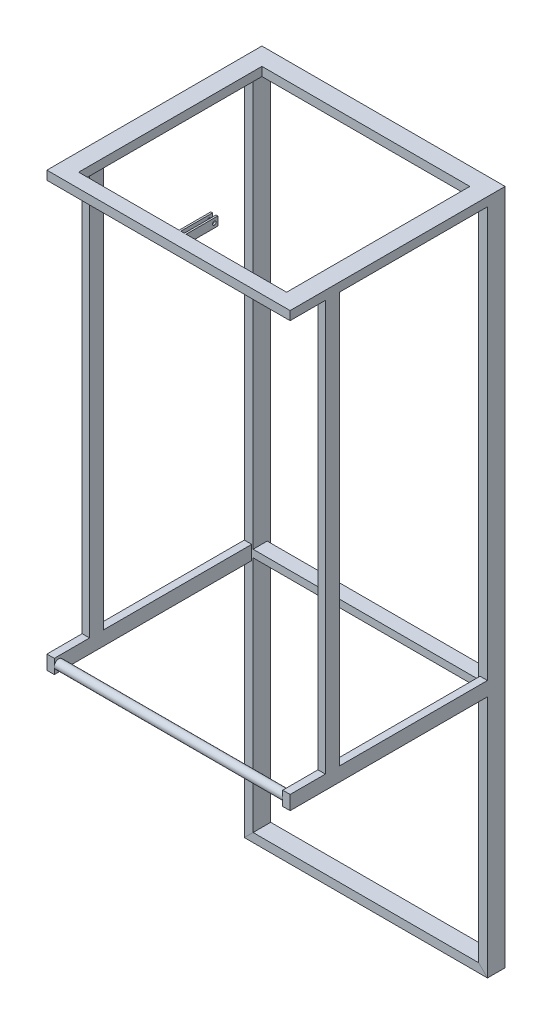
from build123d import *

# Parameters (mm, degrees)
SKETCH5_W            = 50
SKETCH5_H            = 25
SKETCH7_W            = 40
SKETCH7_H            = 21
SKETCH9_W            = 21
SKETCH9_H            = 40
BOSS_EXTRUDE2_DEPTH  = 560
SKETCH10_W           = 50
SKETCH10_H           = 25
BOSS_EXTRUDE3_DEPTH  = 560
SKETCH11_W           = 40
SKETCH11_H           = 25
BOSS_EXTRUDE4_DEPTH  = 590
BOSS_EXTRUDE7_REACH  = 1360.803
SKETCH13_W           = 21
SKETCH13_H           = 40
BOSS_EXTRUDE11_REACH = 1299.213
SKETCH19_R           = 12.5
SKETCH21_W           = 5
SKETCH21_H           = 25
BOSS_EXTRUDE13_DEPTH = 90
SKETCH22_R           = 5
CUT_EXTRUDE1_DEPTH   = 90


with BuildPart() as part:
    # Sweep3: sweep along a path in Sketch1
    with BuildLine(Plane.XY) as sweep3_path:
        Line((-345, 960), (345, 960))
        Line((345, 960), (345, -960))
        Line((345, -960), (-345, -960))
        Line((-345, -960), (-345, 960))
    # Sketch5 → Sweep3 (sweep)
    with BuildSketch(Plane(origin=(-345, 960, 0), x_dir=(0, 0, -1), z_dir=(1, 0, 0))):
        with Locations((25, -12.5)):
            Rectangle(SKETCH5_W, SKETCH5_H)
    sweep(path=sweep3_path.line, transition=Transition.RIGHT)

    # Sweep4: sweep along a path in Sketch6
    with BuildLine(Plane.XY) as sweep4_path:
        Line((-345, -260), (345, -260))
    # Sketch7 → Sweep4 (sweep)
    with BuildSketch(Plane(origin=(345, -260, 0), x_dir=(0, 0, -1), z_dir=(1, 0, 0))):
        with Locations((20, 10.5)):
            Rectangle(SKETCH7_W, SKETCH7_H)
    sweep(path=sweep4_path.line)

    # Sketch9 → Boss-Extrude2 (add)
    with BuildSketch(Plane.XY):
        with Locations((334.5, -249)):
            Rectangle(SKETCH9_W, SKETCH9_H)
    boss_extrude2 = extrude(amount=BOSS_EXTRUDE2_DEPTH)

    # Mirror1: Boss-Extrude2 across plane
    add(boss_extrude2.mirror(Plane(origin=(0, 0, 0), x_dir=(0, 0, 1), z_dir=(1, 0, 0))))

    # Sketch10 → Boss-Extrude3 (add)
    with BuildSketch(Plane.XY):
        with Locations((320, 947.5)):
            Rectangle(SKETCH10_W, SKETCH10_H)
    boss_extrude3 = extrude(amount=BOSS_EXTRUDE3_DEPTH)

    # Mirror3: Boss-Extrude3 across plane
    add(boss_extrude3.mirror(Plane(origin=(0, 0, 0), x_dir=(0, 0, 1), z_dir=(1, 0, 0))))

    # Sketch11 → Boss-Extrude4 (add)
    with BuildSketch(Plane(origin=(-295, 0, 0), x_dir=(0, 0, -1), z_dir=(1, 0, 0))):
        with Locations((-540, 947.5)):
            Rectangle(SKETCH11_W, SKETCH11_H)
    extrude(amount=BOSS_EXTRUDE4_DEPTH)

    # Sketch13 → Boss-Extrude7 (add, up to next)
    with BuildSketch(Plane(origin=(0, -229, 0), x_dir=(1, 0, 0), z_dir=(0, 1, 0)), mode=Mode.PRIVATE) as boss_extrude7_sk1:
        with Locations((-334.5, -440)):
            Rectangle(SKETCH13_W, SKETCH13_H)
    boss_extrude7_tool1 = extrude(boss_extrude7_sk1.sketch, amount=BOSS_EXTRUDE7_REACH, mode=Mode.PRIVATE) - part.part
    boss_extrude7 = boss_extrude7_tool1.solids().sort_by_distance((-334.5, -229, 440))[0]
    add(boss_extrude7)

    # Mirror7: Boss-Extrude7 across plane
    add(boss_extrude7.mirror(Plane(origin=(0, 0, 0), x_dir=(0, 0, 1), z_dir=(1, 0, 0))))

    # Sketch19 → Boss-Extrude11 (add, up to next)
    with BuildSketch(Plane(origin=(-324, 0, 0), x_dir=(0, 0, -1), z_dir=(1, 0, 0)), mode=Mode.PRIVATE) as boss_extrude11_sk1:
        with Locations(Location((-547.5, -249, 0), (0, 0, 180))):
            Circle(SKETCH19_R)
    boss_extrude11_tool1 = extrude(boss_extrude11_sk1.sketch, amount=BOSS_EXTRUDE11_REACH, mode=Mode.PRIVATE) - part.part
    add(boss_extrude11_tool1.solids().sort_by_distance((-324, -249, 547.5))[0])

    # Sketch21 → Boss-Extrude13 (add)
    with BuildSketch(Plane(origin=(0, 0, 520), x_dir=(-1, 0, 0), z_dir=(0, 0, -1))):
        with Locations((-7.5, 947.5)):
            Rectangle(SKETCH21_W, SKETCH21_H)
        with Locations((7.5, 947.5)):
            Rectangle(SKETCH21_W, SKETCH21_H)
    extrude(amount=BOSS_EXTRUDE13_DEPTH)

    # Sketch22 → Cut-Extrude1 (cut)
    with BuildSketch(Plane.ZY.offset(10)):
        with Locations(Location((440, 947.5, 0), (0, 0, 270))):
            Circle(SKETCH22_R)
    extrude(amount=-CUT_EXTRUDE1_DEPTH, mode=Mode.SUBTRACT)


solid = part.part
